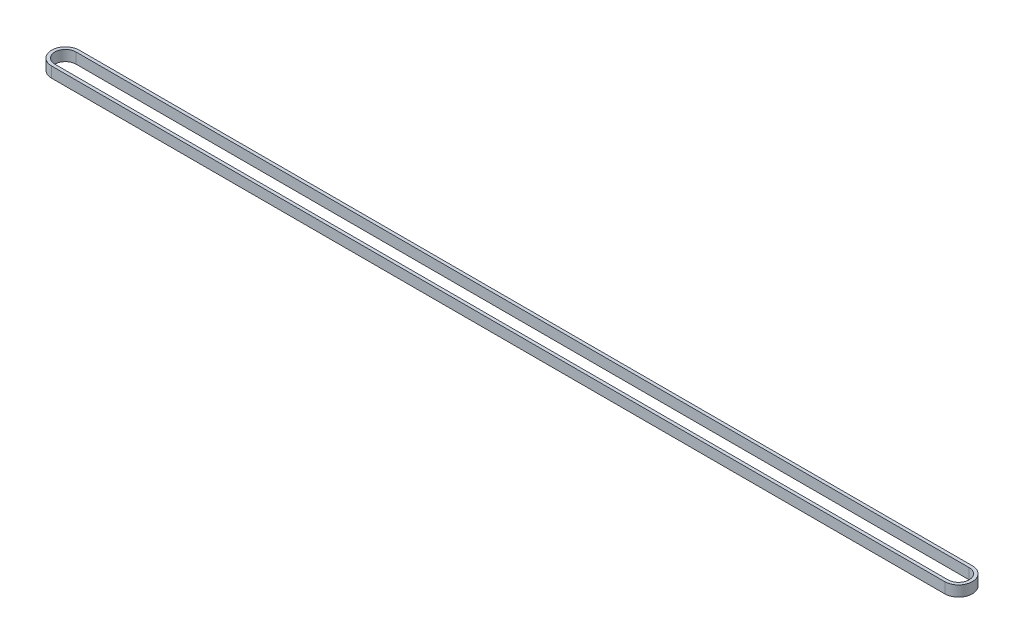
from build123d import *

# Parameters (mm, degrees)
BOSS_EXTRUDE1_DEPTH = 6


with BuildPart() as part:
    # Sketch1 → Boss-Extrude1 (new body)
    with BuildSketch(Plane(origin=(0, 0, 0), x_dir=(1, 0, 0), z_dir=(0, 1, 0))):
        with BuildLine():
            Line((0, 7.8), (505.5, 7.8))
            ThreePointArc((505.5, 7.8), (513.3, 0), (505.5, -7.8))
            Line((505.5, -7.8), (0, -7.8))
            ThreePointArc((0, -7.8), (-7.8, 0), (0, 7.8))
        make_face()
        with BuildLine():
            Line((0, 6), (505.5, 6))
            ThreePointArc((505.5, 6), (511.5, 0), (505.5, -6))
            Line((505.5, -6), (0, -6))
            ThreePointArc((0, -6), (-6, 0), (0, 6))
        make_face(mode=Mode.SUBTRACT)
    extrude(amount=BOSS_EXTRUDE1_DEPTH)


solid = part.part
